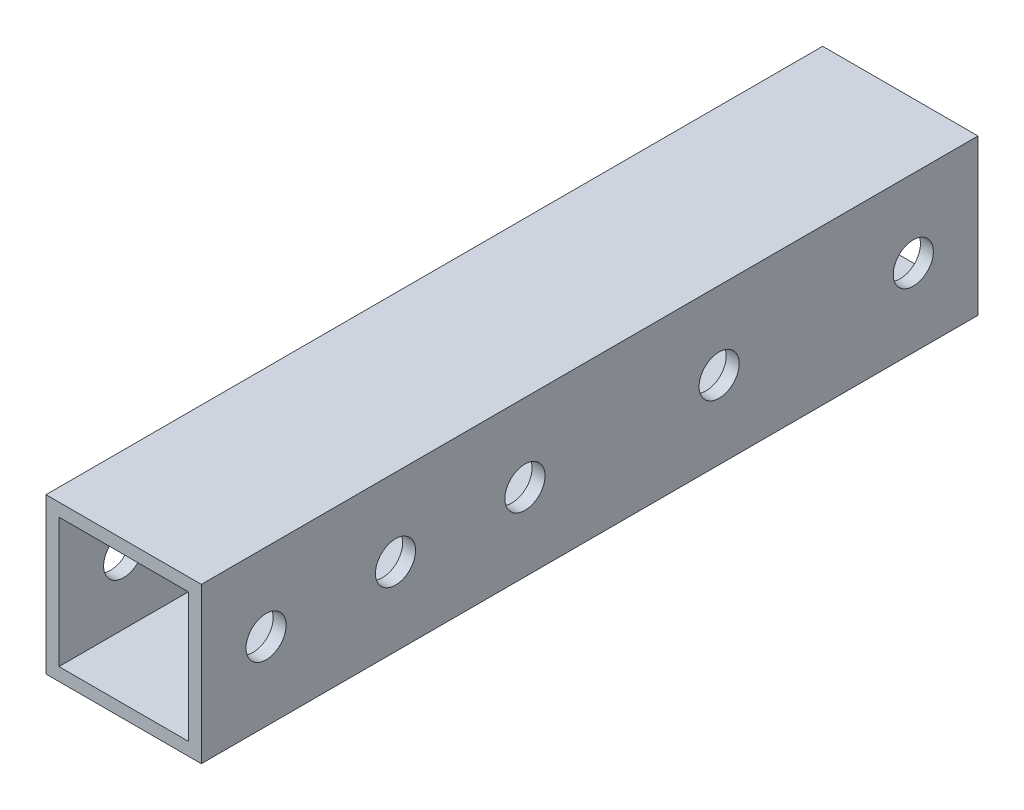
from build123d import *

# Parameters (mm, degrees)
SKETCH_1_W          = 12
SKETCH_1_H          = 12
SKETCH_1_W_2        = 10
SKETCH_1_H_2        = 10
EXTRUDE_1_DEPTH     = 60
SKETCH_2_R          = 1.55
CUT_EXTRUDE_2_DEPTH = 63.353829072


with BuildPart() as part:
    # 草图1 → 凸台-拉伸1 (new body)
    with BuildSketch(Plane.XY):
        with Locations((6, 6)):
            Rectangle(SKETCH_1_W, SKETCH_1_H)
        with Locations((6, 6)):
            Rectangle(SKETCH_1_W_2, SKETCH_1_H_2, mode=Mode.SUBTRACT)
    extrude(amount=EXTRUDE_1_DEPTH)

    # 草图2 → 切除-拉伸2 (cut, through all)
    with BuildSketch(Plane.YZ.offset(12)):
        with Locations(Location((6, 55, 0), (0, 0, 270))):
            Circle(SKETCH_2_R)
        with Locations(Location((6, 45, 0), (0, 0, 270))):
            Circle(SKETCH_2_R)
        with Locations(Location((6, 5, 0), (0, 0, 270))):
            Circle(SKETCH_2_R)
        with Locations(Location((6, 20, 0), (0, 0, 270))):
            Circle(SKETCH_2_R)
        with Locations(Location((6, 35, 0), (0, 0, 270))):
            Circle(SKETCH_2_R)
    extrude(amount=-CUT_EXTRUDE_2_DEPTH, mode=Mode.SUBTRACT)


solid = part.part
